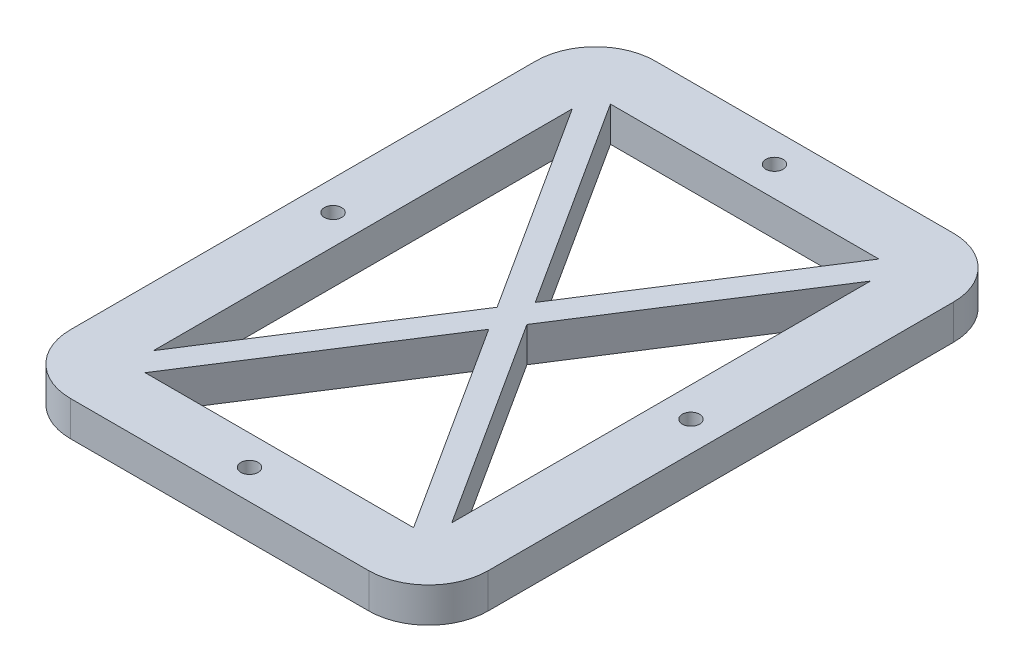
from build123d import *

# Parameters (mm, degrees)
SKETCH1_R           = 1.45
BOSS_EXTRUDE1_DEPTH = 5.85


with BuildPart() as part:
    # Sketch1 → Boss-Extrude1 (new body)
    with BuildSketch(Plane(origin=(0, 0, 0), x_dir=(1, 0, 0), z_dir=(0, 1, 0))):
        with BuildLine():
            ThreePointArc((-25, 49), (-32.071067812, 46.071067812), (-35, 39))
            Line((-35, 39), (-35, -39))
            ThreePointArc((-35, -39), (-32.071067812, -46.071067812), (-25, -49))
            Line((-25, -49), (25, -49))
            ThreePointArc((25, -49), (32.071067812, -46.071067812), (35, -39))
            Line((35, -39), (35, 39))
            ThreePointArc((35, 39), (32.071067812, 46.071067812), (25, 49))
            Line((25, 49), (-25, 49))
        make_face()
        Polygon((-22.5, -39), (0, -3.9), (22.5, -39), align=None, mode=Mode.SUBTRACT)
        Polygon((25, -35.1), (2.5, 0), (25, 35.1), align=None, mode=Mode.SUBTRACT)
        Polygon((22.5, 39), (0, 3.9), (-22.5, 39), align=None, mode=Mode.SUBTRACT)
        Polygon((-25, 35.1), (-2.5, 0), (-25, -35.1), align=None, mode=Mode.SUBTRACT)
        with Locations(Location((0, -44, 0), (0, 0, 270))):
            Circle(SKETCH1_R, mode=Mode.SUBTRACT)
        with Locations(Location((-30, 0, 0), (0, 0, 270))):
            Circle(SKETCH1_R, mode=Mode.SUBTRACT)
        with Locations(Location((0, 44, 0), (0, 0, 270))):
            Circle(SKETCH1_R, mode=Mode.SUBTRACT)
        with Locations(Location((30, 0, 0), (0, 0, 270))):
            Circle(SKETCH1_R, mode=Mode.SUBTRACT)
    extrude(amount=BOSS_EXTRUDE1_DEPTH)


solid = part.part
